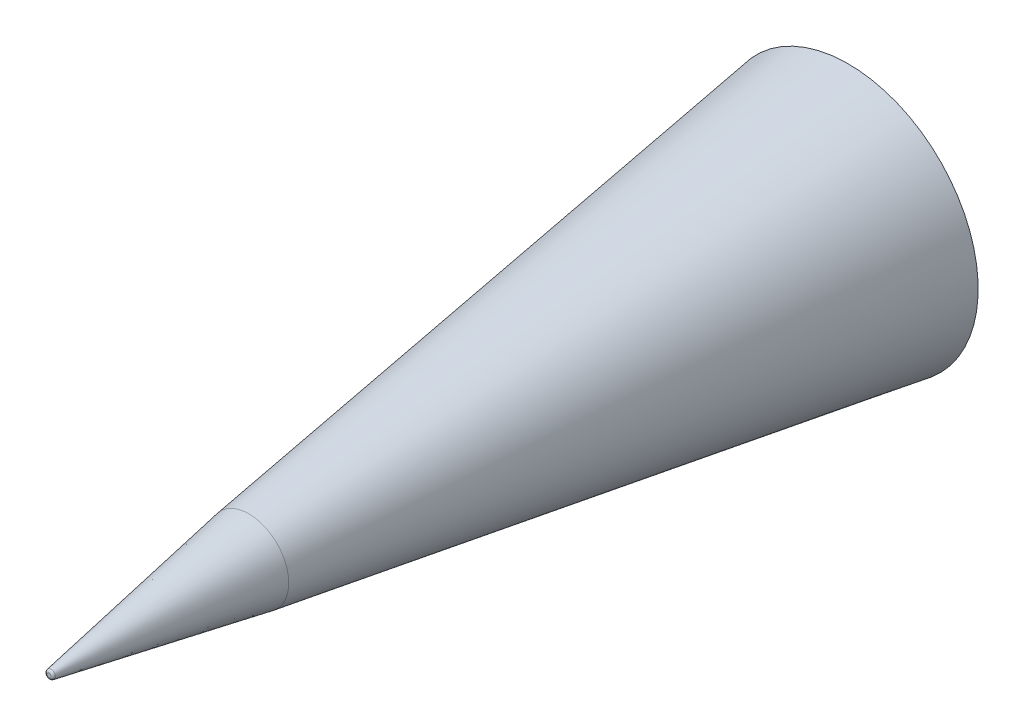
from build123d import *

# Parameters (mm, degrees)
FILLET_3_R = 0.06


with BuildPart() as part:
    # Эскиз1 → Повернуть1 (revolve)
    with BuildSketch(Plane(origin=(0, 0, 0), x_dir=(0, 0, -1), z_dir=(1, 0, 0)), mode=Mode.PRIVATE) as revolve_1_sk:
        Polygon((5, 1), (0, 0.1), (0, 0), (20, 0), (20, 3.25), align=None)
    revolve(revolve_1_sk.sketch.rotate(Axis((0, 0, 107.572785956), (0, 0, -1)), 270), axis=Axis((0, 0, 107.572785956), (0, 0, -1)))

    # Скругление3
    fillet_3_edges = [part.edges().sort_by_distance(p)[0] for p in [
        (0.1, 0, 0),
    ]]
    fillet(fillet_3_edges, radius=FILLET_3_R)


solid = part.part
